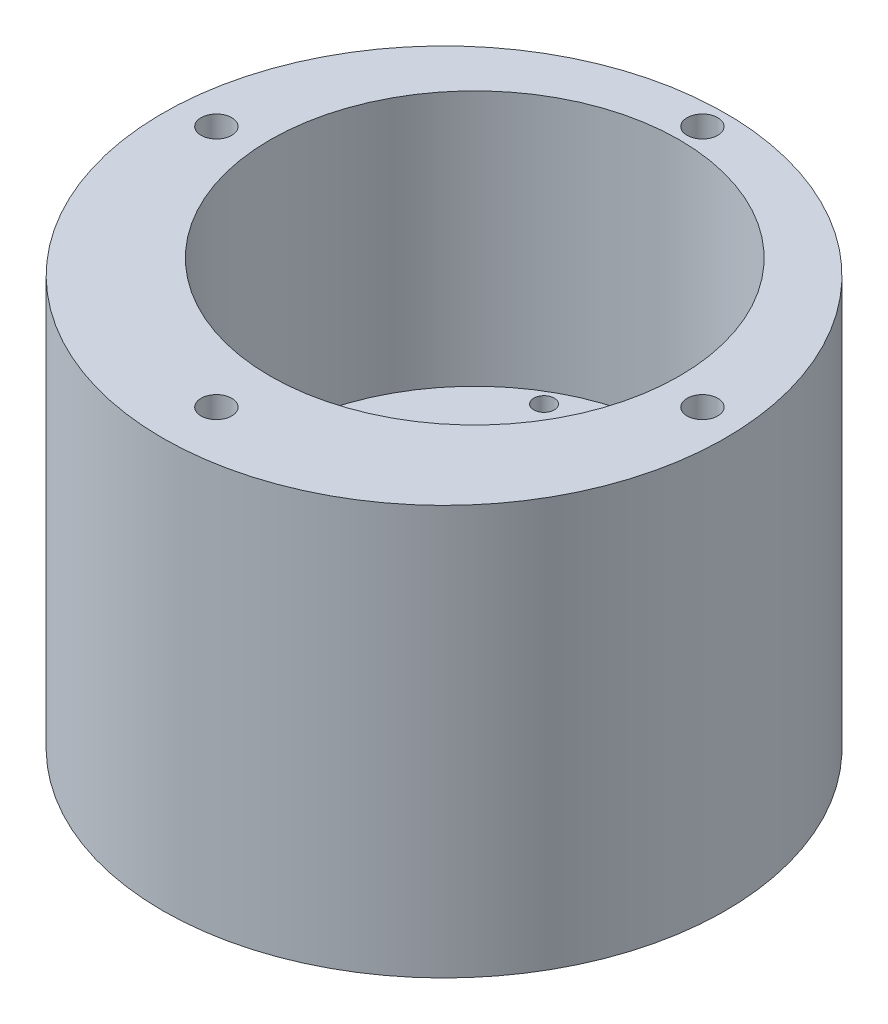
from build123d import *

# Parameters (mm, degrees)
SKETCH1_R                = 27.5
SKETCH1_R_2              = 1
BOSS_EXTRUDE2_DEPTH      = 15
CUT_EXTRUDE17_DEPTH      = 44.720704477
CUT_EXTRUDE17_DEPTH_BACK = 44.720704477
SKETCH2_R                = 9
SKETCH7_R                = 27.5
SKETCH7_R_2              = 20
BOSS_EXTRUDE4_DEPTH      = 25
CUT_EXTRUDE18_DEPTH      = 58.328003628
CUT_EXTRUDE18_DEPTH_BACK = 58.328003628
SKETCH8_R                = 1.5


with BuildPart() as part:
    # Sketch1 → Boss-Extrude2 (new body)
    with BuildSketch(Plane(origin=(0, 0, 0), x_dir=(1, 0, 0), z_dir=(0, 1, 0))):
        with Locations(Location((0, -3, 0), (0, 0, 270))):
            Circle(SKETCH1_R)
        with Locations(Location((9.25, 16.02146997, 0), (0, 0, 270))):
            Circle(SKETCH1_R_2, mode=Mode.SUBTRACT)
        with Locations(Location((18.5, 0, 0), (0, 0, 270))):
            Circle(SKETCH1_R_2, mode=Mode.SUBTRACT)
        with Locations(Location((9.25, -16.02146997, 0), (0, 0, 270))):
            Circle(SKETCH1_R_2, mode=Mode.SUBTRACT)
        with Locations(Location((-9.25, -16.02146997, 0), (0, 0, 270))):
            Circle(SKETCH1_R_2, mode=Mode.SUBTRACT)
        with Locations(Location((-18.5, 0, 0), (0, 0, 270))):
            Circle(SKETCH1_R_2, mode=Mode.SUBTRACT)
        with Locations(Location((-9.25, 16.02146997, 0), (0, 0, 270))):
            Circle(SKETCH1_R_2, mode=Mode.SUBTRACT)
    extrude(amount=BOSS_EXTRUDE2_DEPTH)

    # Sketch2 → Cut-Extrude17 (cut, two sides: drawn at the far end of the back side and taken through both)
    with BuildSketch(Plane(origin=(0, 15, 0), x_dir=(1, 0, 0), z_dir=(0, 1, 0)).offset(-CUT_EXTRUDE17_DEPTH_BACK)):
        with Locations(Location((0, 10, 0), (0, 0, 270))):
            Circle(SKETCH2_R)
    extrude(amount=CUT_EXTRUDE17_DEPTH + CUT_EXTRUDE17_DEPTH_BACK, mode=Mode.SUBTRACT)

    # Sketch7 → Boss-Extrude4 (add)
    with BuildSketch(Plane(origin=(0, 15, 0), x_dir=(1, 0, 0), z_dir=(0, 1, 0))):
        with Locations(Location((0, -3, 0), (0, 0, 270))):
            Circle(SKETCH7_R)
        with Locations(Location((0, 0, 0), (0, 0, 270))):
            Circle(SKETCH7_R_2, mode=Mode.SUBTRACT)
    extrude(amount=BOSS_EXTRUDE4_DEPTH)

    # Sketch8 → Cut-Extrude18 (cut, two sides: drawn at the far end of the back side and taken through both)
    with BuildSketch(Plane(origin=(0, 40, 0), x_dir=(1, 0, 0), z_dir=(0, 1, 0)).offset(-CUT_EXTRUDE18_DEPTH_BACK)):
        with Locations(Location((0, 22.25, 0), (0, 0, 270))):
            Circle(SKETCH8_R)
        with Locations(Location((23.75, -1.5, 0), (0, 0, 270))):
            Circle(SKETCH8_R)
        with Locations(Location((0, -25.25, 0), (0, 0, 270))):
            Circle(SKETCH8_R)
        with Locations(Location((-23.75, -1.5, 0), (0, 0, 270))):
            Circle(SKETCH8_R)
    extrude(amount=CUT_EXTRUDE18_DEPTH + CUT_EXTRUDE18_DEPTH_BACK, mode=Mode.SUBTRACT)


solid = part.part
